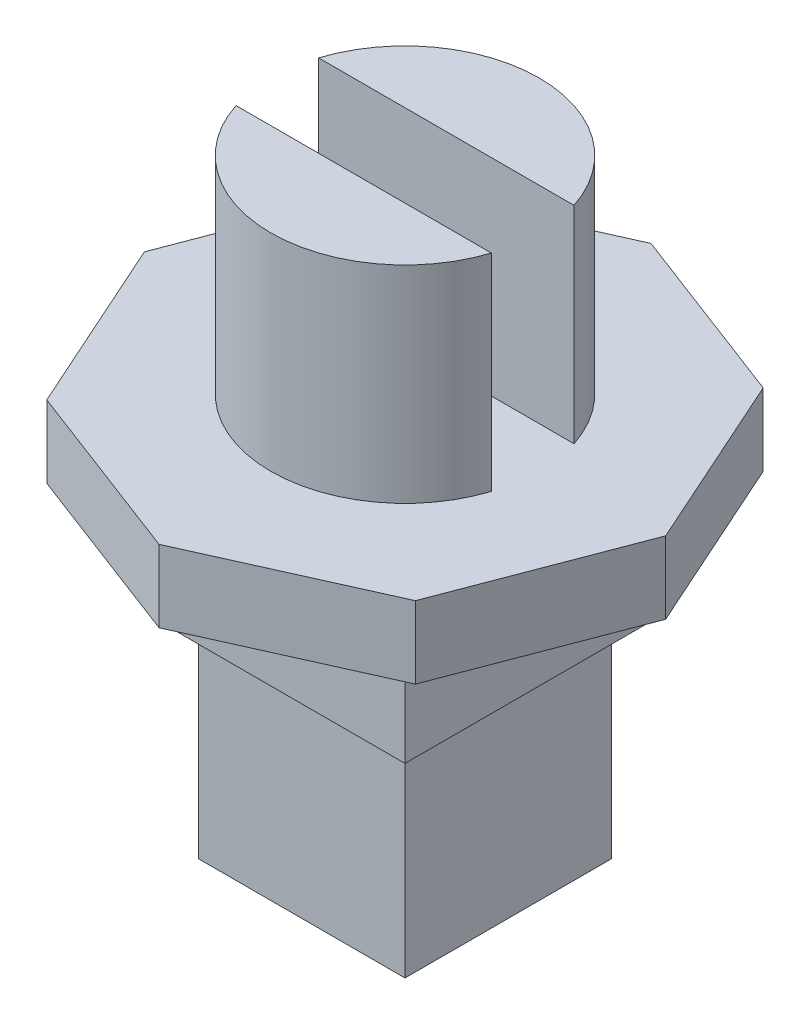
from build123d import *

# Parameters (mm, degrees)
SKETCH1_W            = 10
SKETCH1_H            = 10
BOSS_EXTRUDE1_DEPTH  = 10
SKETCH2_W            = 12
SKETCH2_H            = 12
BOSS_EXTRUDE5_DEPTH  = 6
BOSS_EXTRUDE6_DEPTH  = 3.5
BOSS_EXTRUDE11_DEPTH = 10


with BuildPart() as part:
    # Sketch1 → Boss-Extrude1 (new body)
    with BuildSketch(Plane(origin=(0, 0, 0), x_dir=(1, 0, 0), z_dir=(0, 1, 0))):
        Rectangle(SKETCH1_W, SKETCH1_H)
    extrude(amount=-BOSS_EXTRUDE1_DEPTH)

    # Sketch2 → Boss-Extrude5 (add)
    with BuildSketch(Plane(origin=(0, 0, 0), x_dir=(1, 0, 0), z_dir=(0, 1, 0))):
        Rectangle(SKETCH2_W, SKETCH2_H)
    extrude(amount=BOSS_EXTRUDE5_DEPTH)

    # Sketch4 → Boss-Extrude6 (add)
    with BuildSketch(Plane(origin=(0, 6, 0), x_dir=(1, 0, 0), z_dir=(0, 1, 0))):
        Polygon((0.35623678, -12.266936068), (8.925931121, -8.422136236), (12.266936068, 0.35623678), (8.422136236, 8.925931121), (-0.35623678, 12.266936068), (-8.925931121, 8.422136236), (-12.266936068, -0.35623678), (-8.422136236, -8.925931121), align=None)
    extrude(amount=BOSS_EXTRUDE6_DEPTH)

    # Sketch8 → Boss-Extrude11 (add)
    with BuildSketch(Plane(origin=(0, 9.5, 0), x_dir=(1, 0, 0), z_dir=(0, 1, 0))):
        with BuildLine():
            Line((-6.184658438, 2), (6.184658438, 2))
            ThreePointArc((6.184658438, 2), (0, 6.5), (-6.184658438, 2))
        make_face()
        with BuildLine():
            Line((6.184658438, -2), (-6.184658438, -2))
            ThreePointArc((-6.184658438, -2), (0, -6.5), (6.184658438, -2))
        make_face()
    extrude(amount=BOSS_EXTRUDE11_DEPTH)


solid = part.part
